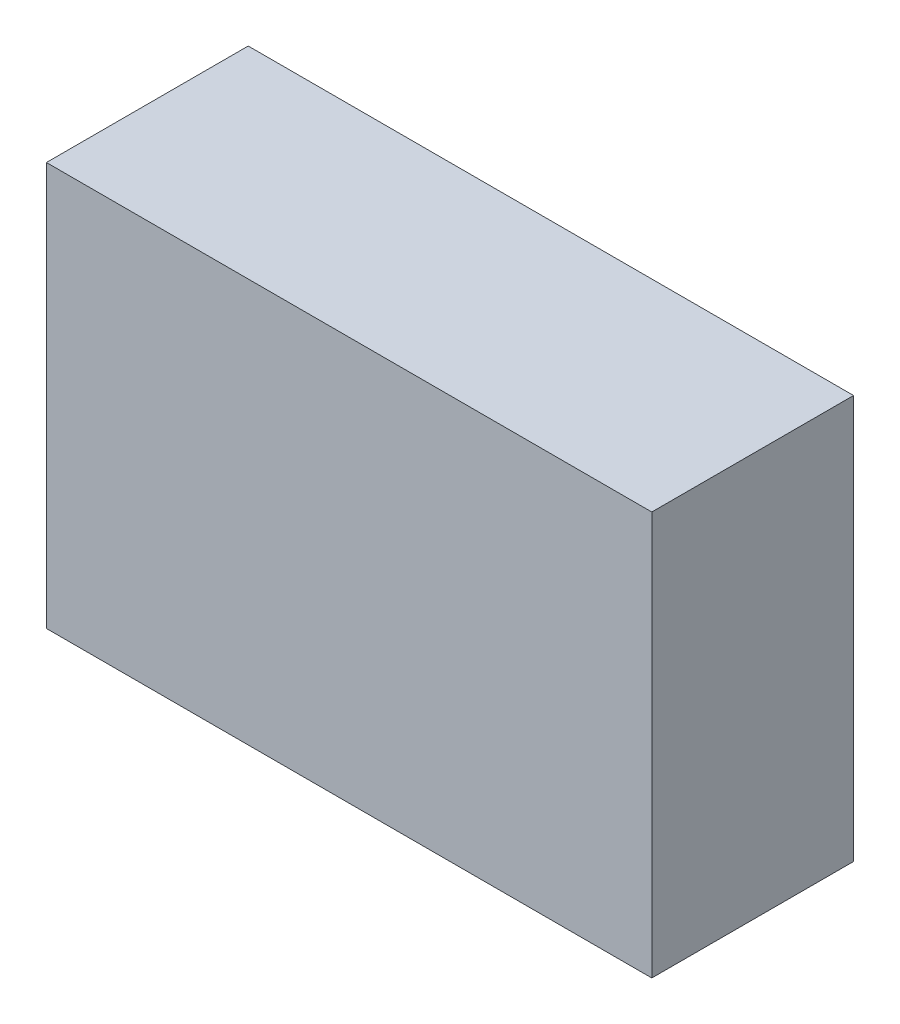
from build123d import *

# Parameters (mm, degrees)
ESBO_O1_W                = 90
ESBO_O1_H                = 60
RESSALTO_EXTRUS_O1_DEPTH = 30


with BuildPart() as part:
    # Esboço1 → Ressalto-extrusão1 (new body)
    with BuildSketch(Plane.XY):
        with Locations((-6.792174024, 10.755942275)):
            Rectangle(ESBO_O1_W, ESBO_O1_H)
    extrude(amount=RESSALTO_EXTRUS_O1_DEPTH)


solid = part.part
